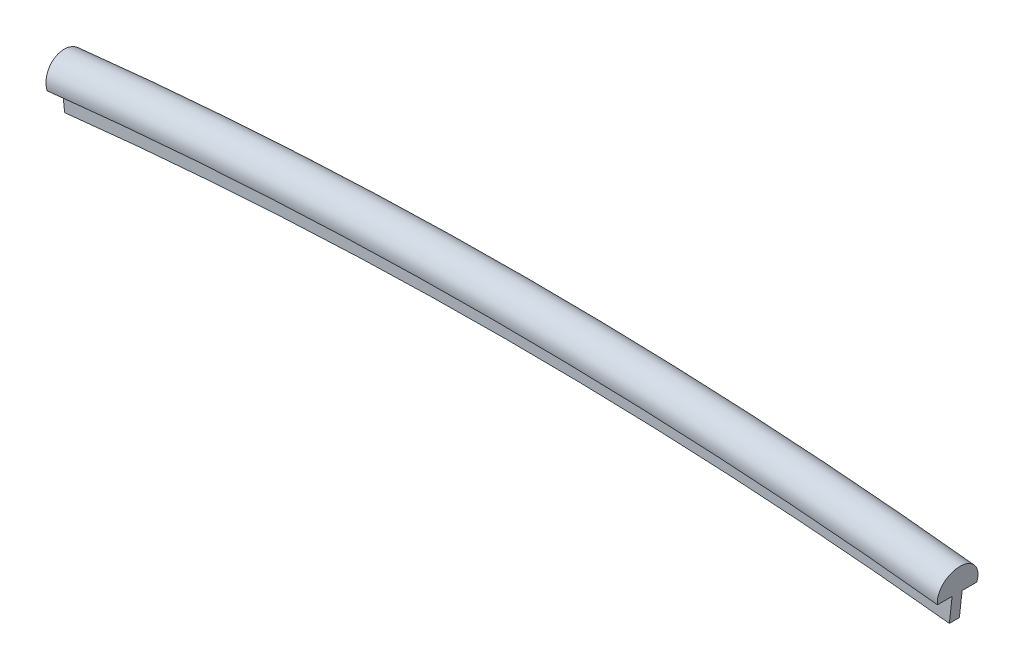
from build123d import *

# Parameters (mm, degrees)
REVOLVE1_ANGLE           = 6.357628646
REVOLVE1_OTHER_WAY_ANGLE = 6.357628646


with BuildPart() as part:
    # Sketch2 → Revolve1 (revolve)
    with BuildSketch(Plane(origin=(0, 0, 0), x_dir=(0, 0, -1), z_dir=(1, 0, 0))):
        with BuildLine():
            Line((0, 239.8), (0.3, 239.8))
            Line((0.3, 239.8), (0.3, 241.3))
            Line((0.3, 241.3), (1.18, 241.3))
            ThreePointArc((1.18, 241.3), (0, 242.800182019), (-1.18, 241.3))
            Line((-1.18, 241.3), (-0.3, 241.3))
            Line((-0.3, 241.3), (-0.3, 239.8))
            Line((-0.3, 239.8), (0, 239.8))
        make_face()
    revolve(axis=Axis((0, 0, 70.597641597), (0, 0, -1)), revolution_arc=REVOLVE1_ANGLE)

    # Sketch2 → Revolve1 other way (revolve)
    with BuildSketch(Plane(origin=(0, 0, 0), x_dir=(0, 0, -1), z_dir=(1, 0, 0))):
        with BuildLine():
            Line((0, 239.8), (0.3, 239.8))
            Line((0.3, 239.8), (0.3, 241.3))
            Line((0.3, 241.3), (1.18, 241.3))
            ThreePointArc((1.18, 241.3), (0, 242.800182019), (-1.18, 241.3))
            Line((-1.18, 241.3), (-0.3, 241.3))
            Line((-0.3, 241.3), (-0.3, 239.8))
            Line((-0.3, 239.8), (0, 239.8))
        make_face()
    revolve(axis=Axis((0, 0, 70.597641597), (0, 0, 1)), revolution_arc=REVOLVE1_OTHER_WAY_ANGLE)


solid = part.part
